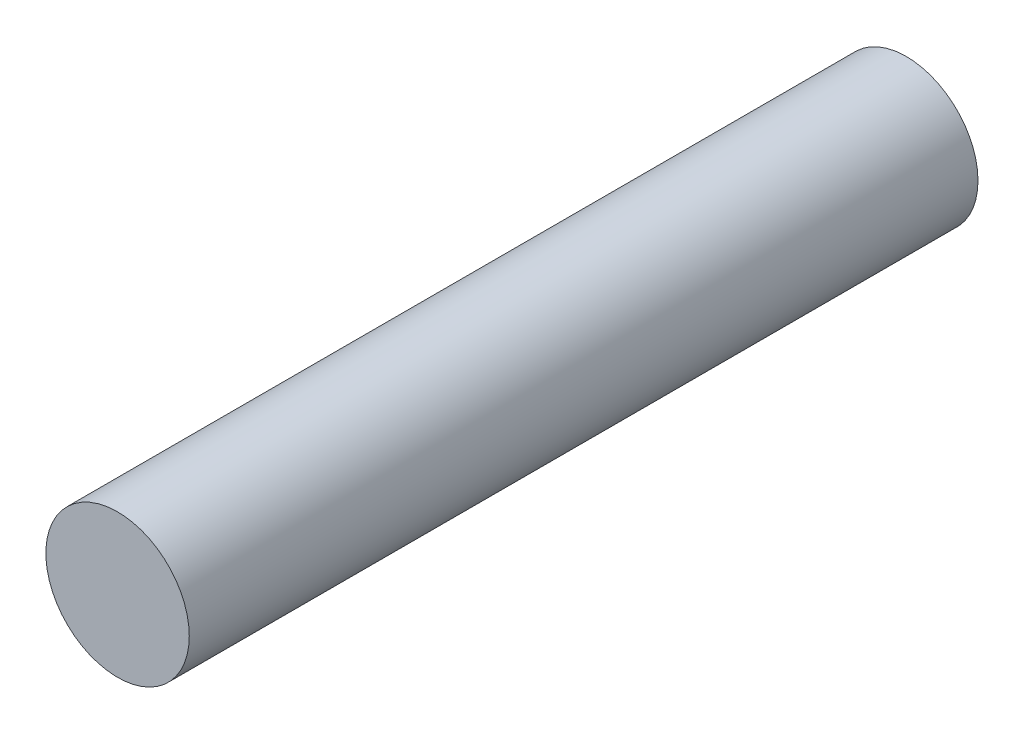
from build123d import *

# Parameters (mm, degrees)
SKETCH1_R           = 1
BOSS_EXTRUDE1_DEPTH = 11


with BuildPart() as part:
    # Sketch1 → Boss-Extrude1 (new body)
    with BuildSketch(Plane.XY):
        Circle(SKETCH1_R)
    extrude(amount=BOSS_EXTRUDE1_DEPTH)


solid = part.part
